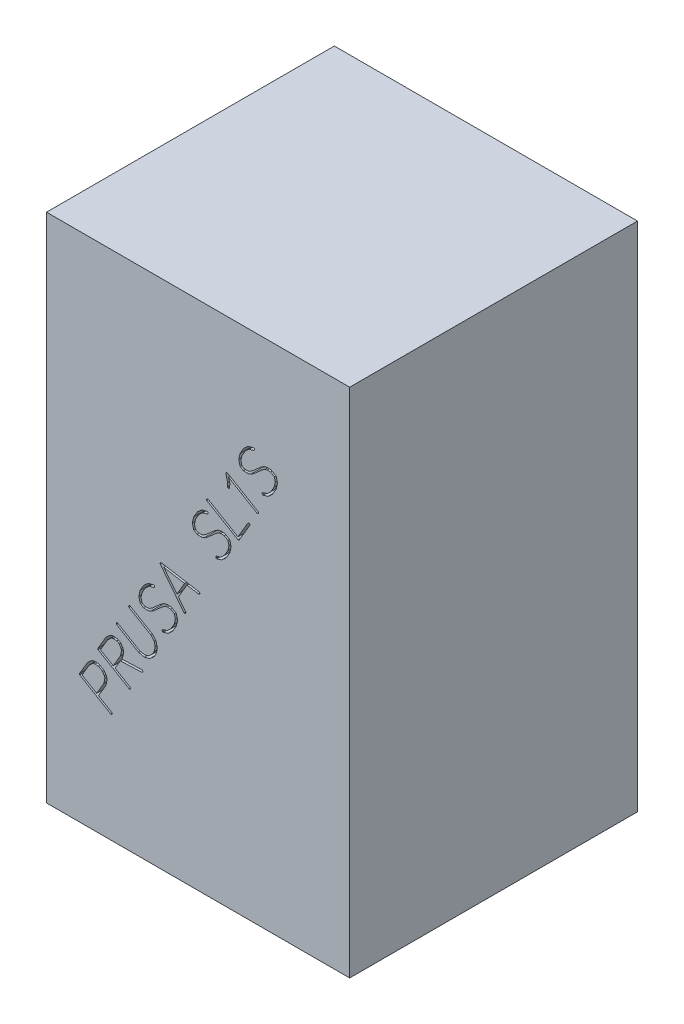
from build123d import *

# Parameters (mm, degrees)
SKETCH1_W           = 237
SKETCH1_H           = 225
BOSS_EXTRUDE1_DEPTH = 400
CUT_EXTRUDE1_DEPTH  = 10


with BuildPart() as part:
    # Sketch1 → Boss-Extrude1 (new body)
    with BuildSketch(Plane(origin=(0, 0, 0), x_dir=(1, 0, 0), z_dir=(0, 1, 0))):
        Rectangle(SKETCH1_W, SKETCH1_H)
    extrude(amount=BOSS_EXTRUDE1_DEPTH)

    # Sketch2 → Cut-Extrude1 (cut)
    # profile 1 of 9: a face of its own
    with BuildSketch(Plane.XY.offset(112.5)):
        with BuildLine():
            add(Edge.make_bspline(
                [(35.778543298, 317.308124803), (35.877040943, 317.393792287), (36.084996192, 317.574659586), (36.416167595, 317.858900146), (36.778572841, 318.17947466), (37.178133588, 318.525376974), (37.604437568, 318.910523101), (38.065976907, 319.321349269), (38.564258813, 319.762228323), (38.905585722, 320.06833694), (39.082114727, 320.226651588)],
                knots=[0, 0, 0, 0, 0.710714246, 1.500510576, 2.376035372, 3.344923501, 4.377705294, 5.503836424, 6.709022758, 8, 8, 8, 8], degree=3))
            add(Edge.make_bspline(
                [(39.082114727, 320.226651588), (39.176795353, 320.258851624), (39.387368698, 320.330465738), (39.737940496, 320.4340587), (40.15495934, 320.551885846), (40.634846682, 320.684097052), (41.181144498, 320.831467169), (41.791839244, 320.985608201), (42.469452768, 321.152739849), (42.941879433, 321.270105687), (43.189257584, 321.331562303)],
                knots=[0, 0, 0, 0, 0.564128498, 1.254643417, 2.061841092, 3.008894917, 4.062716452, 5.253833597, 6.562016889, 8, 8, 8, 8], degree=3))
            add(Edge.make_bspline(
                [(43.189257584, 321.331562303), (43.280184906, 321.333272937), (43.452563069, 321.336515923), (43.607241511, 321.261147867), (43.680329012, 321.225535517)],
                knots=[0, 0, 0, 0, 1.054974954, 2, 2, 2, 2], degree=3))
            add(Edge.make_bspline(
                [(43.680329012, 321.225535517), (43.721416927, 321.201873234), (43.793607019, 321.160299394), (43.847040167, 321.096690567), (43.870061155, 321.069285517)],
                knots=[0, 0, 0, 0, 1.138325568, 2, 2, 2, 2], degree=3))
            add(Edge.make_bspline(
                [(43.870061155, 321.069285517), (43.916454168, 321.013910097), (44.007720772, 320.904972861), (44.082450358, 320.699783826), (44.092100083, 320.475024182), (44.056222736, 320.326563969), (44.03747187, 320.248973017)],
                knots=[0, 0, 0, 0, 0.978819244, 1.925581099, 2.915829813, 4, 4, 4, 4], degree=3))
            add(Edge.make_bspline(
                [(44.03747187, 320.248973017), (43.993205306, 320.172883413), (43.911565362, 320.032552867), (43.768047428, 319.863373719), (43.645703485, 319.722320629), (43.546306855, 319.673676814), (43.501757584, 319.651874803)],
                knots=[0, 0, 0, 0, 1.292847548, 2.384373082, 3.275880872, 4, 4, 4, 4], degree=3))
            Line((43.501757584, 319.651874803), (39.908007584, 318.71995516))
            Line((39.908007584, 318.71995516), (36.972739727, 316.14183016))
            Line((36.972739727, 316.14183016), (34.266266512, 311.565937303))
            Line((34.266266512, 311.565937303), (33.418052227, 307.849419445))
            Line((33.418052227, 307.849419445), (34.227204012, 304.646294445))
            Line((34.227204012, 304.646294445), (36.051980798, 303.56370516))
            Line((36.051980798, 303.56370516), (38.713811155, 303.429776588))
            Line((38.713811155, 303.429776588), (40.231668298, 303.870624803))
            Line((40.231668298, 303.870624803), (42.720507584, 305.55589266))
            Line((42.720507584, 305.55589266), (49.126757584, 311.203214088))
            Line((49.126757584, 311.203214088), (51.688141512, 312.854999803))
            add(Edge.make_bspline(
                [(51.688141512, 312.854999803), (51.860698851, 312.906796304), (52.238543859, 313.020213964), (52.866313376, 313.168602277), (53.602346972, 313.310891328), (54.130259381, 313.399393235), (54.411355798, 313.44651766)],
                knots=[0, 0, 0, 0, 0.775019935, 1.697044106, 2.773749891, 4, 4, 4, 4], degree=3))
            Line((54.411355798, 313.44651766), (57.089927227, 313.25120516))
            add(Edge.make_bspline(
                [(57.089927227, 313.25120516), (57.201541122, 313.18797307), (57.43781714, 313.054116741), (57.81165983, 312.841989554), (58.226951191, 312.606609336), (58.683574095, 312.345856533), (59.178361854, 312.054328061), (59.716074827, 311.743374963), (60.289945271, 311.400128553), (60.689022434, 311.167472165), (60.895730798, 311.046964088)],
                knots=[0, 0, 0, 0, 0.700007414, 1.481849224, 2.345525519, 3.304882817, 4.351158632, 5.479265799, 6.694345629, 8, 8, 8, 8], degree=3))
            Line((60.895730798, 311.046964088), (61.096623655, 310.740044445))
            Line((61.096623655, 310.740044445), (62.022962941, 306.80589266))
            add(Edge.make_bspline(
                [(62.022962941, 306.80589266), (62.003773491, 306.655032006), (61.959534782, 306.307242959), (61.849824468, 305.721014843), (61.690032164, 305.002599804), (61.569473546, 304.478798595), (61.503989727, 304.194285517)],
                knots=[0, 0, 0, 0, 0.684898989, 1.578942961, 2.684954564, 4, 4, 4, 4], degree=3))
            Line((61.503989727, 304.194285517), (61.063141512, 302.263481945))
            Line((61.063141512, 302.263481945), (58.072070084, 297.207678374))
            add(Edge.make_bspline(
                [(58.072070084, 297.207678374), (57.977329722, 297.120115765), (57.775261952, 296.933357125), (57.453507664, 296.641435557), (57.101484524, 296.314209352), (56.710487725, 295.962994373), (56.279326246, 295.585429192), (55.81852486, 295.171674046), (55.319723605, 294.731381062), (54.978471246, 294.425188317), (54.801980798, 294.26683016)],
                knots=[0, 0, 0, 0, 0.703981311, 1.501492399, 2.370711845, 3.326641466, 4.369382731, 5.498101253, 6.706056617, 8, 8, 8, 8], degree=3))
            Line((54.801980798, 294.26683016), (54.550864727, 294.132901588))
            Line((54.550864727, 294.132901588), (50.823186155, 293.000089088))
            add(Edge.make_bspline(
                [(50.823186155, 293.000089088), (50.747593504, 293.015543311), (50.548182464, 293.056311067), (50.373570548, 293.162776912), (50.265150441, 293.228883731)],
                knots=[0, 0, 0, 0, 0.758159134, 2, 2, 2, 2], degree=3))
            add(Edge.make_bspline(
                [(50.265150441, 293.228883731), (50.218697931, 293.291935843), (50.127699127, 293.415452671), (50.055114181, 293.634534212), (50.037947131, 293.86823763), (50.066170097, 294.023450037), (50.080998655, 294.104999803)],
                knots=[0, 0, 0, 0, 1.005767381, 1.970262281, 2.933560538, 4, 4, 4, 4], degree=3))
            add(Edge.make_bspline(
                [(50.080998655, 294.104999803), (50.127422411, 294.180845954), (50.211846645, 294.318776484), (50.35530305, 294.489860713), (50.488720024, 294.618602043), (50.589377307, 294.665027676), (50.633454012, 294.685356945)],
                knots=[0, 0, 0, 0, 1.307030055, 2.376908326, 3.289266187, 4, 4, 4, 4], degree=3))
            Line((50.633454012, 294.685356945), (54.003989727, 295.75120516))
            Line((54.003989727, 295.75120516), (56.816489727, 298.346071231))
            Line((56.816489727, 298.346071231), (59.539704012, 302.949865874))
            Line((59.539704012, 302.949865874), (60.343275441, 306.671964088))
            Line((60.343275441, 306.671964088), (59.595507584, 309.886249803))
            Line((59.595507584, 309.886249803), (56.671400441, 311.616160517))
            Line((56.671400441, 311.616160517), (54.015150441, 311.755669445))
            Line((54.015150441, 311.755669445), (52.408007584, 311.320401588))
            Line((52.408007584, 311.320401588), (49.919168298, 309.635133731))
            Line((49.919168298, 309.635133731), (43.579882584, 304.015714088))
            Line((43.579882584, 304.015714088), (41.007337941, 302.336026588))
            add(Edge.make_bspline(
                [(41.007337941, 302.336026588), (40.761982101, 302.262861747), (40.275687606, 302.117849263), (39.787273302, 301.980145781), (39.54528437, 301.911919445)],
                knots=[0, 0, 0, 0, 1.009083353, 2, 2, 2, 2], degree=3))
            add(Edge.make_bspline(
                [(39.54528437, 301.911919445), (39.402724088, 301.87145811), (39.13495644, 301.795460528), (38.74961073, 301.737268188), (38.409037868, 301.707872397), (38.202051272, 301.744277439), (38.105552227, 301.761249803)],
                knots=[0, 0, 0, 0, 1.214717975, 2.281576415, 3.198855204, 4, 4, 4, 4], degree=3))
            add(Edge.make_bspline(
                [(38.105552227, 301.761249803), (38.031139774, 301.766729245), (37.861826612, 301.779196807), (37.579308704, 301.802632143), (37.238855229, 301.824649176), (36.859050971, 301.843278016), (36.476185477, 301.872462983), (36.126472097, 301.89476784), (35.826801032, 301.910205216), (35.64460073, 301.922851575), (35.56090937, 301.928660517)],
                knots=[0, 0, 0, 0, 0.702189196, 1.597714749, 2.667847535, 3.912713514, 5.176149666, 6.281220926, 7.21050098, 8, 8, 8, 8], degree=3))
            Line((35.56090937, 301.928660517), (32.977204012, 303.452098017))
            add(Edge.make_bspline(
                [(32.977204012, 303.452098017), (32.937655505, 303.479591537), (32.853568061, 303.538047847), (32.769916615, 303.680835128), (32.69418031, 303.849844024), (32.651641163, 304.046124907), (32.62419122, 304.235557507), (32.593978321, 304.387399072), (32.579750379, 304.490523168), (32.568150926, 304.540300897), (32.564257584, 304.557008731)],
                knots=[0, 0, 0, 0, 0.941468605, 2.001736437, 3.203565702, 4.603275245, 5.944822685, 6.990332666, 7.661106386, 8, 8, 8, 8], degree=3))
            Line((32.564257584, 304.557008731), (31.783007584, 307.648526588))
            Line((31.783007584, 307.648526588), (31.794168298, 307.972187303))
            add(Edge.make_bspline(
                [(31.794168298, 307.972187303), (31.819577303, 308.100670287), (31.873091955, 308.371272079), (31.970996174, 308.796201832), (32.076158197, 309.265137764), (32.19402983, 309.778376589), (32.320772755, 310.337228572), (32.467063041, 310.937333915), (32.623611766, 311.580858609), (32.731639683, 312.023533227), (32.78747187, 312.252321231)],
                knots=[0, 0, 0, 0, 0.715295004, 1.506503851, 2.381467221, 3.340189223, 4.382672976, 5.511255477, 6.713739459, 8, 8, 8, 8], degree=3))
            Line((32.78747187, 312.252321231), (32.837695084, 312.414151588))
            Line((32.837695084, 312.414151588), (35.778543298, 317.308124803))
        make_face()
    # profile 2 of 9: a face of its own
    with BuildSketch(Plane.XY.offset(112.5)):
        with BuildLine():
            Line((22.494978668, 294.263182615), (22.835380454, 294.19621833))
            Line((22.835380454, 294.19621833), (47.093192954, 279.854700473))
            add(Edge.make_bspline(
                [(47.093192954, 279.854700473), (47.151828053, 279.796829986), (47.263750385, 279.686367141), (47.355485879, 279.461164994), (47.351098366, 279.207014978), (47.288674171, 279.044090355), (47.255023311, 278.956262973)],
                knots=[0, 0, 0, 0, 0.991990795, 1.893506187, 2.864457477, 4, 4, 4, 4], degree=3))
            add(Edge.make_bspline(
                [(47.255023311, 278.956262973), (47.19549637, 278.862222588), (47.08795704, 278.692332456), (46.890839338, 278.498479914), (46.675736879, 278.38605218), (46.528827242, 278.390482027), (46.45703224, 278.392646901)],
                knots=[0, 0, 0, 0, 1.28529316, 2.321966526, 3.179942047, 4, 4, 4, 4], degree=3))
            Line((46.45703224, 278.392646901), (46.244978668, 278.426129044))
            Line((46.244978668, 278.426129044), (23.856585811, 291.668316544))
            Line((23.856585811, 291.668316544), (24.827567954, 287.957379044))
            Line((24.827567954, 287.957379044), (24.576451883, 284.737512973))
            add(Edge.make_bspline(
                [(24.576451883, 284.737512973), (24.572651633, 284.70715226), (24.564153344, 284.639258266), (24.52894921, 284.580347813), (24.509487597, 284.54778083)],
                knots=[0, 0, 0, 0, 0.894356357, 2, 2, 2, 2], degree=3))
            add(Edge.make_bspline(
                [(24.509487597, 284.54778083), (24.445695072, 284.465734679), (24.313195896, 284.295322119), (24.010127756, 284.14872792), (23.651052184, 284.108724378), (23.433733052, 284.214058981), (23.320871526, 284.268762973)],
                knots=[0, 0, 0, 0, 0.912684627, 1.895676054, 2.907150005, 4, 4, 4, 4], degree=3))
            add(Edge.make_bspline(
                [(23.320871526, 284.268762973), (23.27912592, 284.297502402), (23.200422278, 284.351685299), (23.130494339, 284.416771097), (23.09765724, 284.447334401)],
                knots=[0, 0, 0, 0, 1.060830323, 2, 2, 2, 2], degree=3))
            add(Edge.make_bspline(
                [(23.09765724, 284.447334401), (23.042727912, 284.543394025), (22.941401876, 284.720591553), (22.926094833, 284.923582323), (22.919085811, 285.01653083)],
                knots=[0, 0, 0, 0, 1.084209533, 2, 2, 2, 2], degree=3))
            Line((22.919085811, 285.01653083), (23.125559026, 287.812289758))
            Line((23.125559026, 287.812289758), (21.696987597, 293.292200473))
            add(Edge.make_bspline(
                [(21.696987597, 293.292200473), (21.69035415, 293.371615562), (21.675713948, 293.546886872), (21.758007745, 293.703306215), (21.803014383, 293.788852258)],
                knots=[0, 0, 0, 0, 0.906196109, 2, 2, 2, 2], degree=3))
            add(Edge.make_bspline(
                [(21.803014383, 293.788852258), (21.839796332, 293.842923869), (21.915334031, 293.953968692), (22.076293878, 294.086396858), (22.270370378, 294.196273226), (22.41750087, 294.240102469), (22.494978668, 294.263182615)],
                knots=[0, 0, 0, 0, 0.908199104, 1.865134192, 2.875795909, 4, 4, 4, 4], degree=3))
        make_face()
    # profile 3 of 9: a face of its own
    with BuildSketch(Plane.XY.offset(112.5)):
        with BuildLine():
            Line((7.61267342, 268.889872259), (7.841468063, 268.800586544))
            Line((7.841468063, 268.800586544), (31.150619849, 255.017104402))
            Line((31.150619849, 255.017104402), (39.041244849, 268.365318687))
            add(Edge.make_bspline(
                [(39.041244849, 268.365318687), (39.100516626, 268.431503787), (39.212387818, 268.556423376), (39.437652166, 268.663869317), (39.683990886, 268.680771561), (39.84018556, 268.631421108), (39.922941278, 268.605274044)],
                knots=[0, 0, 0, 0, 1.071592764, 2.022553815, 2.952301171, 4, 4, 4, 4], degree=3))
            add(Edge.make_bspline(
                [(39.922941278, 268.605274044), (40.018789306, 268.545579485), (40.195341803, 268.435621838), (40.39820587, 268.234867858), (40.535327461, 268.026592227), (40.547674971, 267.877757594), (40.553521635, 267.807282973)],
                knots=[0, 0, 0, 0, 1.269355503, 2.338158531, 3.213102186, 4, 4, 4, 4], degree=3))
            Line((40.553521635, 267.807282973), (40.475396635, 267.522684759))
            Line((40.475396635, 267.522684759), (32.021155563, 253.231390116))
            add(Edge.make_bspline(
                [(32.021155563, 253.231390116), (31.962772185, 253.178347372), (31.85119811, 253.076979563), (31.634759872, 253.001918087), (31.404254075, 252.995922494), (31.255785068, 253.044355283), (31.178521635, 253.069559759)],
                knots=[0, 0, 0, 0, 1.026456168, 1.9616182, 2.939223888, 4, 4, 4, 4], degree=3))
            Line((31.178521635, 253.069559759), (6.853744849, 267.450140116))
            add(Edge.make_bspline(
                [(6.853744849, 267.450140116), (6.804709919, 267.512762317), (6.709630893, 267.634187144), (6.641954264, 267.856239182), (6.640764683, 268.090112342), (6.692704233, 268.237933807), (6.719816278, 268.315095473)],
                knots=[0, 0, 0, 0, 1.022800667, 1.983216686, 2.947254651, 4, 4, 4, 4], degree=3))
            add(Edge.make_bspline(
                [(6.719816278, 268.315095473), (6.773082048, 268.398926454), (6.875625765, 268.56031228), (7.09610088, 268.733012924), (7.340825446, 268.856356379), (7.520010942, 268.878447989), (7.61267342, 268.889872259)],
                knots=[0, 0, 0, 0, 1.068799334, 2.05758134, 2.995513966, 4, 4, 4, 4], degree=3))
        make_face()
    # profile 4 of 9: a face of its own
    with BuildSketch(Plane.XY.offset(112.5)):
        with BuildLine():
            add(Edge.make_bspline(
                [(-0.44965067, 256.163493632), (-0.351153025, 256.249161116), (-0.143197776, 256.430028416), (0.187973626, 256.714268975), (0.550378872, 257.03484349), (0.949939619, 257.380745804), (1.3762436, 257.76589193), (1.837782939, 258.176718098), (2.336064845, 258.617597153), (2.677391754, 258.92370577), (2.853920758, 259.082020418)],
                knots=[0, 0, 0, 0, 0.710714246, 1.500510576, 2.376035372, 3.344923501, 4.377705294, 5.503836424, 6.709022758, 8, 8, 8, 8], degree=3))
            add(Edge.make_bspline(
                [(2.853920758, 259.082020418), (2.948601385, 259.114220453), (3.15917473, 259.185834567), (3.509746527, 259.289427529), (3.926765372, 259.407254676), (4.406652714, 259.539465881), (4.952950529, 259.686835998), (5.563645276, 259.840977031), (6.2412588, 260.008108679), (6.713685465, 260.125474517), (6.961063615, 260.186931132)],
                knots=[0, 0, 0, 0, 0.564128498, 1.254643417, 2.061841092, 3.008894917, 4.062716452, 5.253833597, 6.562016889, 8, 8, 8, 8], degree=3))
            add(Edge.make_bspline(
                [(6.961063615, 260.186931132), (7.051990938, 260.188641767), (7.224369101, 260.191884753), (7.379047543, 260.116516697), (7.452135044, 260.080904346)],
                knots=[0, 0, 0, 0, 1.054974954, 2, 2, 2, 2], degree=3))
            add(Edge.make_bspline(
                [(7.452135044, 260.080904346), (7.493222958, 260.057242064), (7.565413051, 260.015668223), (7.618846198, 259.952059396), (7.641867187, 259.924654346)],
                knots=[0, 0, 0, 0, 1.138325568, 2, 2, 2, 2], degree=3))
            add(Edge.make_bspline(
                [(7.641867187, 259.924654346), (7.6882602, 259.869278926), (7.779526804, 259.760341691), (7.85425639, 259.555152655), (7.863906115, 259.330393012), (7.828028767, 259.181932798), (7.809277901, 259.104341846)],
                knots=[0, 0, 0, 0, 0.978819244, 1.925581099, 2.915829813, 4, 4, 4, 4], degree=3))
            add(Edge.make_bspline(
                [(7.809277901, 259.104341846), (7.765011338, 259.028252243), (7.683371394, 258.887921697), (7.53985346, 258.718742548), (7.417509517, 258.577689459), (7.318112886, 258.529045644), (7.273563615, 258.507243632)],
                knots=[0, 0, 0, 0, 1.292847548, 2.384373082, 3.275880872, 4, 4, 4, 4], degree=3))
            Line((7.273563615, 258.507243632), (3.679813615, 257.575323989))
            Line((3.679813615, 257.575323989), (0.744545758, 254.997198989))
            Line((0.744545758, 254.997198989), (-1.961927456, 250.421306132))
            Line((-1.961927456, 250.421306132), (-2.810141742, 246.704788275))
            Line((-2.810141742, 246.704788275), (-2.000989956, 243.501663275))
            Line((-2.000989956, 243.501663275), (-0.17621317, 242.419073989))
            Line((-0.17621317, 242.419073989), (2.485617187, 242.285145418))
            Line((2.485617187, 242.285145418), (4.00347433, 242.725993632))
            Line((4.00347433, 242.725993632), (6.492313615, 244.411261489))
            Line((6.492313615, 244.411261489), (12.898563615, 250.058582918))
            Line((12.898563615, 250.058582918), (15.459947544, 251.710368632))
            add(Edge.make_bspline(
                [(15.459947544, 251.710368632), (15.632504882, 251.762165133), (16.01034989, 251.875582793), (16.638119408, 252.023971106), (17.374153004, 252.166260158), (17.902065413, 252.254762064), (18.18316183, 252.301886489)],
                knots=[0, 0, 0, 0, 0.775019935, 1.697044106, 2.773749891, 4, 4, 4, 4], degree=3))
            Line((18.18316183, 252.301886489), (20.861733258, 252.106573989))
            add(Edge.make_bspline(
                [(20.861733258, 252.106573989), (20.973347154, 252.0433419), (21.209623172, 251.90948557), (21.583465861, 251.697358384), (21.998757223, 251.461978166), (22.455380126, 251.201225363), (22.950167885, 250.90969689), (23.487880858, 250.598743792), (24.061751302, 250.255497382), (24.460828466, 250.022840994), (24.66753683, 249.902332918)],
                knots=[0, 0, 0, 0, 0.700007414, 1.481849224, 2.345525519, 3.304882817, 4.351158632, 5.479265799, 6.694345629, 8, 8, 8, 8], degree=3))
            Line((24.66753683, 249.902332918), (24.868429687, 249.595413275))
            Line((24.868429687, 249.595413275), (25.794768973, 245.661261489))
            add(Edge.make_bspline(
                [(25.794768973, 245.661261489), (25.775579523, 245.510400836), (25.731340814, 245.162611788), (25.621630499, 244.576383672), (25.461838195, 243.857968634), (25.341279577, 243.334167424), (25.275795758, 243.049654346)],
                knots=[0, 0, 0, 0, 0.684898989, 1.578942961, 2.684954564, 4, 4, 4, 4], degree=3))
            Line((25.275795758, 243.049654346), (24.834947544, 241.118850775))
            Line((24.834947544, 241.118850775), (21.843876115, 236.063047204))
            add(Edge.make_bspline(
                [(21.843876115, 236.063047204), (21.749135753, 235.975484595), (21.547067983, 235.788725955), (21.225313695, 235.496804386), (20.873290555, 235.169578182), (20.482293757, 234.818363203), (20.051132278, 234.440798022), (19.590330892, 234.027042876), (19.091529636, 233.586749892), (18.750277278, 233.280557147), (18.57378683, 233.122198989)],
                knots=[0, 0, 0, 0, 0.703981311, 1.501492399, 2.370711845, 3.326641466, 4.369382731, 5.498101253, 6.706056617, 8, 8, 8, 8], degree=3))
            Line((18.57378683, 233.122198989), (18.322670758, 232.988270418))
            Line((18.322670758, 232.988270418), (14.594992187, 231.855457918))
            add(Edge.make_bspline(
                [(14.594992187, 231.855457918), (14.519399536, 231.870912141), (14.319988496, 231.911679896), (14.145376579, 232.018145742), (14.036956473, 232.084252561)],
                knots=[0, 0, 0, 0, 0.758159134, 2, 2, 2, 2], degree=3))
            add(Edge.make_bspline(
                [(14.036956473, 232.084252561), (13.990503962, 232.147304672), (13.899505158, 232.270821501), (13.826920212, 232.489903042), (13.809753163, 232.723606459), (13.837976128, 232.878818866), (13.852804687, 232.960368632)],
                knots=[0, 0, 0, 0, 1.005767381, 1.970262281, 2.933560538, 4, 4, 4, 4], degree=3))
            add(Edge.make_bspline(
                [(13.852804687, 232.960368632), (13.899228442, 233.036214783), (13.983652677, 233.174145314), (14.127109082, 233.345229542), (14.260526056, 233.473970873), (14.361183338, 233.520396506), (14.405260044, 233.540725775)],
                knots=[0, 0, 0, 0, 1.307030055, 2.376908326, 3.289266187, 4, 4, 4, 4], degree=3))
            Line((14.405260044, 233.540725775), (17.775795758, 234.606573989))
            Line((17.775795758, 234.606573989), (20.588295758, 237.201440061))
            Line((20.588295758, 237.201440061), (23.311510044, 241.805234704))
            Line((23.311510044, 241.805234704), (24.115081473, 245.527332918))
            Line((24.115081473, 245.527332918), (23.367313615, 248.741618632))
            Line((23.367313615, 248.741618632), (20.443206473, 250.471529346))
            Line((20.443206473, 250.471529346), (17.786956473, 250.611038275))
            Line((17.786956473, 250.611038275), (16.179813615, 250.175770418))
            Line((16.179813615, 250.175770418), (13.69097433, 248.490502561))
            Line((13.69097433, 248.490502561), (7.351688615, 242.871082918))
            Line((7.351688615, 242.871082918), (4.779143973, 241.191395418))
            add(Edge.make_bspline(
                [(4.779143973, 241.191395418), (4.533788133, 241.118230576), (4.047493638, 240.973218092), (3.559079333, 240.835514611), (3.317090401, 240.767288275)],
                knots=[0, 0, 0, 0, 1.009083353, 2, 2, 2, 2], degree=3))
            add(Edge.make_bspline(
                [(3.317090401, 240.767288275), (3.17453012, 240.726826939), (2.906762471, 240.650829358), (2.521416762, 240.592637017), (2.1808439, 240.563241226), (1.973857303, 240.599646268), (1.877358258, 240.616618632)],
                knots=[0, 0, 0, 0, 1.214717975, 2.281576415, 3.198855204, 4, 4, 4, 4], degree=3))
            add(Edge.make_bspline(
                [(1.877358258, 240.616618632), (1.802945806, 240.622098075), (1.633632643, 240.634565636), (1.351114735, 240.658000973), (1.010661261, 240.680018006), (0.630857003, 240.698646846), (0.247991508, 240.727831812), (-0.101721871, 240.75013667), (-0.401392937, 240.765574045), (-0.583593238, 240.778220404), (-0.667284599, 240.784029346)],
                knots=[0, 0, 0, 0, 0.702189196, 1.597714749, 2.667847535, 3.912713514, 5.176149666, 6.281220926, 7.21050098, 8, 8, 8, 8], degree=3))
            Line((-0.667284599, 240.784029346), (-3.250989956, 242.307466846))
            add(Edge.make_bspline(
                [(-3.250989956, 242.307466846), (-3.290538464, 242.334960367), (-3.374625907, 242.393416677), (-3.458277354, 242.536203958), (-3.534013658, 242.705212854), (-3.576552805, 242.901493737), (-3.604002748, 243.090926336), (-3.634215647, 243.242767901), (-3.64844359, 243.345891998), (-3.660043042, 243.395669727), (-3.663936385, 243.412377561)],
                knots=[0, 0, 0, 0, 0.941468605, 2.001736437, 3.203565702, 4.603275245, 5.944822685, 6.990332666, 7.661106386, 8, 8, 8, 8], degree=3))
            Line((-3.663936385, 243.412377561), (-4.445186385, 246.503895418))
            Line((-4.445186385, 246.503895418), (-4.43402567, 246.827556132))
            add(Edge.make_bspline(
                [(-4.43402567, 246.827556132), (-4.408616666, 246.956039116), (-4.355102013, 247.226640909), (-4.257197795, 247.651570662), (-4.152035771, 248.120506593), (-4.034164138, 248.633745419), (-3.907421213, 249.192597401), (-3.761130927, 249.792702745), (-3.604582203, 250.436227439), (-3.496554285, 250.878902056), (-3.440722099, 251.107690061)],
                knots=[0, 0, 0, 0, 0.715295004, 1.506503851, 2.381467221, 3.340189223, 4.382672976, 5.511255477, 6.713739459, 8, 8, 8, 8], degree=3))
            Line((-3.440722099, 251.107690061), (-3.390498885, 251.269520418))
            Line((-3.390498885, 251.269520418), (-0.44965067, 256.163493632))
        make_face()
    # profile 5 of 9: a face of its own
    with BuildSketch(Plane.XY.offset(112.5)):
        with BuildLine():
            Line((-28.823840696, 207.489171256), (0.830177161, 202.57845697))
            add(Edge.make_bspline(
                [(0.830177161, 202.57845697), (0.897319236, 202.536430088), (1.022634953, 202.457990022), (1.171090224, 202.307022294), (1.283437415, 202.148974095), (1.346113072, 201.971194309), (1.360403578, 201.782118388), (1.339565789, 201.581381989), (1.259801382, 201.372665994), (1.187029404, 201.234603833), (1.148257518, 201.161046256)],
                knots=[0, 0, 0, 0, 1.138355934, 2.124657143, 3.032318744, 3.914656472, 4.803494014, 5.748440273, 6.800400662, 8, 8, 8, 8], degree=3))
            add(Edge.make_bspline(
                [(1.148257518, 201.161046256), (1.073957054, 201.11226635), (0.924456273, 201.014115765), (0.65635616, 200.940034249), (0.362755308, 200.908068447), (0.160381744, 200.938600055), (0.054507518, 200.954573042)],
                knots=[0, 0, 0, 0, 0.926323999, 1.863866688, 2.882455506, 4, 4, 4, 4], degree=3))
            add(Edge.make_bspline(
                [(0.054507518, 200.954573042), (-0.128194673, 200.986069389), (-0.499047821, 201.050001407), (-0.864826667, 201.138478939), (-1.050403196, 201.183367685)],
                knots=[0, 0, 0, 0, 0.985307481, 2, 2, 2, 2], degree=3))
            Line((-1.050403196, 201.183367685), (-8.71781391, 202.411046256))
            Line((-8.71781391, 202.411046256), (-15.430983553, 191.060599827))
            Line((-15.430983553, 191.060599827), (-9.705537125, 183.661046256))
            add(Edge.make_bspline(
                [(-9.705537125, 183.661046256), (-9.663333325, 183.60008081), (-9.582941124, 183.483950358), (-9.543755052, 183.271127789), (-9.572923178, 183.049558743), (-9.644836963, 182.913399051), (-9.683215696, 182.840733756)],
                knots=[0, 0, 0, 0, 1.002888197, 1.910358533, 2.884806428, 4, 4, 4, 4], degree=3))
            add(Edge.make_bspline(
                [(-9.683215696, 182.840733756), (-9.736085225, 182.756628363), (-9.833042162, 182.602388267), (-10.039825641, 182.442074219), (-10.271324536, 182.358434878), (-10.428640325, 182.378474439), (-10.509108553, 182.388724827)],
                knots=[0, 0, 0, 0, 1.169091903, 2.143986745, 3.050635031, 4, 4, 4, 4], degree=3))
            add(Edge.make_bspline(
                [(-10.509108553, 182.388724827), (-10.527614954, 182.394682091), (-10.580538859, 182.41171845), (-10.672659065, 182.42470551), (-10.770841274, 182.457799349), (-10.832888514, 182.483323023), (-10.860671053, 182.494751613)],
                knots=[0, 0, 0, 0, 0.633348993, 1.811227536, 3.019945812, 4, 4, 4, 4], degree=3))
            add(Edge.make_bspline(
                [(-10.860671053, 182.494751613), (-10.899033432, 182.517791921), (-10.95950454, 182.554110654), (-10.997462834, 182.612802372), (-11.011340696, 182.634260542)],
                knots=[0, 0, 0, 0, 1.268783707, 2, 2, 2, 2], degree=3))
            Line((-11.011340696, 182.634260542), (-29.588349625, 206.194528399))
            add(Edge.make_bspline(
                [(-29.588349625, 206.194528399), (-29.616443115, 206.260521804), (-29.671122655, 206.388967538), (-29.686427964, 206.597822854), (-29.682385956, 206.809398017), (-29.63509169, 206.944882692), (-29.610671053, 207.014840899)],
                knots=[0, 0, 0, 0, 1.013171244, 1.971977723, 2.952820303, 4, 4, 4, 4], degree=3))
            add(Edge.make_bspline(
                [(-29.610671053, 207.014840899), (-29.562121834, 207.088444741), (-29.469717363, 207.228536057), (-29.280771394, 207.385058184), (-29.060075331, 207.475325319), (-28.904680049, 207.484433185), (-28.823840696, 207.489171256)],
                knots=[0, 0, 0, 0, 1.091025863, 2.076566173, 2.999395974, 4, 4, 4, 4], degree=3))
        make_face()
        Polygon((-16.502412125, 192.50033197), (-10.497947839, 202.65658197), (-26.798171053, 205.396537327), align=None, mode=Mode.SUBTRACT)
    # profile 6 of 9: a face of its own
    with BuildSketch(Plane.XY.offset(112.5)):
        with BuildLine():
            add(Edge.make_bspline(
                [(-42.321432644, 185.493819415), (-42.222934999, 185.579486899), (-42.01497975, 185.760354199), (-41.683808347, 186.044594758), (-41.321403101, 186.365169272), (-40.921842354, 186.711071587), (-40.495538374, 187.096217713), (-40.033999035, 187.507043881), (-39.535717129, 187.947922936), (-39.19439022, 188.254031553), (-39.017861215, 188.412346201)],
                knots=[0, 0, 0, 0, 0.710714246, 1.500510576, 2.376035372, 3.344923501, 4.377705294, 5.503836424, 6.709022758, 8, 8, 8, 8], degree=3))
            add(Edge.make_bspline(
                [(-39.017861215, 188.412346201), (-38.923180589, 188.444546236), (-38.712607244, 188.51616035), (-38.362035446, 188.619753312), (-37.945016602, 188.737580459), (-37.46512926, 188.869791664), (-36.918831444, 189.017161781), (-36.308136698, 189.171302814), (-35.630523174, 189.338434462), (-35.158096509, 189.4558003), (-34.910718358, 189.517256915)],
                knots=[0, 0, 0, 0, 0.564128498, 1.254643417, 2.061841092, 3.008894917, 4.062716452, 5.253833597, 6.562016889, 8, 8, 8, 8], degree=3))
            add(Edge.make_bspline(
                [(-34.910718358, 189.517256915), (-34.819791036, 189.51896755), (-34.647412873, 189.522210536), (-34.492734431, 189.44684248), (-34.41964693, 189.411230129)],
                knots=[0, 0, 0, 0, 1.054974954, 2, 2, 2, 2], degree=3))
            add(Edge.make_bspline(
                [(-34.41964693, 189.411230129), (-34.378559015, 189.387567847), (-34.306368923, 189.345994006), (-34.252935775, 189.282385179), (-34.229914787, 189.254980129)],
                knots=[0, 0, 0, 0, 1.138325568, 2, 2, 2, 2], degree=3))
            add(Edge.make_bspline(
                [(-34.229914787, 189.254980129), (-34.183521774, 189.199604709), (-34.09225517, 189.090667474), (-34.017525584, 188.885478438), (-34.007875859, 188.660718795), (-34.043753206, 188.512258581), (-34.062504072, 188.434667629)],
                knots=[0, 0, 0, 0, 0.978819244, 1.925581099, 2.915829813, 4, 4, 4, 4], degree=3))
            add(Edge.make_bspline(
                [(-34.062504072, 188.434667629), (-34.106770636, 188.358578026), (-34.18841058, 188.21824748), (-34.331928514, 188.049068331), (-34.454272457, 187.908015242), (-34.553669087, 187.859371427), (-34.598218358, 187.837569415)],
                knots=[0, 0, 0, 0, 1.292847548, 2.384373082, 3.275880872, 4, 4, 4, 4], degree=3))
            Line((-34.598218358, 187.837569415), (-38.191968358, 186.905649772))
            Line((-38.191968358, 186.905649772), (-41.127236215, 184.327524772))
            Line((-41.127236215, 184.327524772), (-43.83370943, 179.751631915))
            Line((-43.83370943, 179.751631915), (-44.681923715, 176.035114058))
            Line((-44.681923715, 176.035114058), (-43.87277193, 172.831989058))
            Line((-43.87277193, 172.831989058), (-42.047995144, 171.749399772))
            Line((-42.047995144, 171.749399772), (-39.386164787, 171.615471201))
            Line((-39.386164787, 171.615471201), (-37.868307644, 172.056319415))
            Line((-37.868307644, 172.056319415), (-35.379468358, 173.741587272))
            Line((-35.379468358, 173.741587272), (-28.973218358, 179.388908701))
            Line((-28.973218358, 179.388908701), (-26.41183443, 181.040694415))
            add(Edge.make_bspline(
                [(-26.41183443, 181.040694415), (-26.239277092, 181.092490916), (-25.861432083, 181.205908576), (-25.233662566, 181.354296889), (-24.49762897, 181.496585941), (-23.969716561, 181.585087847), (-23.688620144, 181.632212272)],
                knots=[0, 0, 0, 0, 0.775019935, 1.697044106, 2.773749891, 4, 4, 4, 4], degree=3))
            Line((-23.688620144, 181.632212272), (-21.010048715, 181.436899772))
            add(Edge.make_bspline(
                [(-21.010048715, 181.436899772), (-20.89843482, 181.373667683), (-20.662158802, 181.239811353), (-20.288316112, 181.027684167), (-19.873024751, 180.792303949), (-19.416401848, 180.531551146), (-18.921614088, 180.240022673), (-18.383901115, 179.929069575), (-17.810030671, 179.585823165), (-17.410953508, 179.353166777), (-17.204245144, 179.232658701)],
                knots=[0, 0, 0, 0, 0.700007414, 1.481849224, 2.345525519, 3.304882817, 4.351158632, 5.479265799, 6.694345629, 8, 8, 8, 8], degree=3))
            Line((-17.204245144, 179.232658701), (-17.003352287, 178.925739058))
            Line((-17.003352287, 178.925739058), (-16.077013001, 174.991587272))
            add(Edge.make_bspline(
                [(-16.077013001, 174.991587272), (-16.096202451, 174.840726619), (-16.14044116, 174.492937571), (-16.250151475, 173.906709455), (-16.409943778, 173.188294417), (-16.530502397, 172.664493207), (-16.595986215, 172.379980129)],
                knots=[0, 0, 0, 0, 0.684898989, 1.578942961, 2.684954564, 4, 4, 4, 4], degree=3))
            Line((-16.595986215, 172.379980129), (-17.03683443, 170.449176558))
            Line((-17.03683443, 170.449176558), (-20.027905858, 165.393372986))
            add(Edge.make_bspline(
                [(-20.027905858, 165.393372986), (-20.12264622, 165.305810377), (-20.32471399, 165.119051738), (-20.646468278, 164.827130169), (-20.998491419, 164.499903965), (-21.389488217, 164.148688985), (-21.820649696, 163.771123804), (-22.281451082, 163.357368659), (-22.780252337, 162.917075675), (-23.121504696, 162.61088293), (-23.297995144, 162.452524772)],
                knots=[0, 0, 0, 0, 0.703981311, 1.501492399, 2.370711845, 3.326641466, 4.369382731, 5.498101253, 6.706056617, 8, 8, 8, 8], degree=3))
            Line((-23.297995144, 162.452524772), (-23.549111215, 162.318596201))
            Line((-23.549111215, 162.318596201), (-27.276789787, 161.185783701))
            add(Edge.make_bspline(
                [(-27.276789787, 161.185783701), (-27.352382438, 161.201237924), (-27.551793478, 161.242005679), (-27.726405394, 161.348471525), (-27.834825501, 161.414578344)],
                knots=[0, 0, 0, 0, 0.758159134, 2, 2, 2, 2], degree=3))
            add(Edge.make_bspline(
                [(-27.834825501, 161.414578344), (-27.881278011, 161.477630455), (-27.972276815, 161.601147284), (-28.044861761, 161.820228825), (-28.062028811, 162.053932242), (-28.033805845, 162.209144649), (-28.018977287, 162.290694415)],
                knots=[0, 0, 0, 0, 1.005767381, 1.970262281, 2.933560538, 4, 4, 4, 4], degree=3))
            add(Edge.make_bspline(
                [(-28.018977287, 162.290694415), (-27.972553531, 162.366540566), (-27.888129297, 162.504471097), (-27.744672892, 162.675555325), (-27.611255918, 162.804296656), (-27.510598635, 162.850722289), (-27.46652193, 162.871051558)],
                knots=[0, 0, 0, 0, 1.307030055, 2.376908326, 3.289266187, 4, 4, 4, 4], degree=3))
            Line((-27.46652193, 162.871051558), (-24.095986215, 163.936899772))
            Line((-24.095986215, 163.936899772), (-21.283486215, 166.531765844))
            Line((-21.283486215, 166.531765844), (-18.56027193, 171.135560486))
            Line((-18.56027193, 171.135560486), (-17.756700501, 174.857658701))
            Line((-17.756700501, 174.857658701), (-18.504468358, 178.071944415))
            Line((-18.504468358, 178.071944415), (-21.428575501, 179.801855129))
            Line((-21.428575501, 179.801855129), (-24.084825501, 179.941364058))
            Line((-24.084825501, 179.941364058), (-25.691968358, 179.506096201))
            Line((-25.691968358, 179.506096201), (-28.180807644, 177.820828344))
            Line((-28.180807644, 177.820828344), (-34.520093358, 172.201408701))
            Line((-34.520093358, 172.201408701), (-37.092638001, 170.521721201))
            add(Edge.make_bspline(
                [(-37.092638001, 170.521721201), (-37.337993841, 170.448556359), (-37.824288336, 170.303543875), (-38.31270264, 170.165840394), (-38.554691572, 170.097614058)],
                knots=[0, 0, 0, 0, 1.009083353, 2, 2, 2, 2], degree=3))
            add(Edge.make_bspline(
                [(-38.554691572, 170.097614058), (-38.697251854, 170.057152722), (-38.965019502, 169.981155141), (-39.350365212, 169.9229628), (-39.690938074, 169.893567009), (-39.89792467, 169.929972051), (-39.994423715, 169.946944415)],
                knots=[0, 0, 0, 0, 1.214717975, 2.281576415, 3.198855204, 4, 4, 4, 4], degree=3))
            add(Edge.make_bspline(
                [(-39.994423715, 169.946944415), (-40.068836168, 169.952423858), (-40.23814933, 169.964891419), (-40.520667238, 169.988326756), (-40.861120713, 170.010343789), (-41.240924971, 170.028972629), (-41.623790465, 170.058157595), (-41.973503845, 170.080462452), (-42.27317491, 170.095899828), (-42.455375212, 170.108546187), (-42.539066572, 170.114355129)],
                knots=[0, 0, 0, 0, 0.702189196, 1.597714749, 2.667847535, 3.912713514, 5.176149666, 6.281220926, 7.21050098, 8, 8, 8, 8], degree=3))
            Line((-42.539066572, 170.114355129), (-45.12277193, 171.637792629))
            add(Edge.make_bspline(
                [(-45.12277193, 171.637792629), (-45.162320437, 171.665286149), (-45.246407881, 171.72374246), (-45.330059328, 171.866529741), (-45.405795632, 172.035538637), (-45.448334779, 172.23181952), (-45.475784722, 172.421252119), (-45.505997621, 172.573093684), (-45.520225563, 172.676217781), (-45.531825016, 172.725995509), (-45.535718358, 172.742703344)],
                knots=[0, 0, 0, 0, 0.941468605, 2.001736437, 3.203565702, 4.603275245, 5.944822685, 6.990332666, 7.661106386, 8, 8, 8, 8], degree=3))
            Line((-45.535718358, 172.742703344), (-46.316968358, 175.834221201))
            Line((-46.316968358, 175.834221201), (-46.305807644, 176.157881915))
            add(Edge.make_bspline(
                [(-46.305807644, 176.157881915), (-46.280398639, 176.286364899), (-46.226883987, 176.556966692), (-46.128979769, 176.981896445), (-46.023817745, 177.450832376), (-45.905946112, 177.964071202), (-45.779203187, 178.522923184), (-45.632912901, 179.123028528), (-45.476364176, 179.766553222), (-45.368336259, 180.209227839), (-45.312504072, 180.438015844)],
                knots=[0, 0, 0, 0, 0.715295004, 1.506503851, 2.381467221, 3.340189223, 4.382672976, 5.511255477, 6.713739459, 8, 8, 8, 8], degree=3))
            Line((-45.312504072, 180.438015844), (-45.262280858, 180.599846201))
            Line((-45.262280858, 180.599846201), (-42.321432644, 185.493819415))
        make_face()
    # profile 7 of 9: a face of its own
    with BuildSketch(Plane.XY.offset(112.5)):
        with BuildLine():
            Line((-63.0566844, 149.689945521), (-62.827889757, 149.600659806))
            Line((-62.827889757, 149.600659806), (-45.623648685, 139.427668735))
            Line((-45.623648685, 139.427668735), (-41.929452257, 138.679900878))
            Line((-41.929452257, 138.679900878), (-38.648202257, 139.572758021))
            Line((-38.648202257, 139.572758021), (-35.701773685, 142.201106235))
            Line((-35.701773685, 142.201106235), (-34.379229042, 144.438829449))
            Line((-34.379229042, 144.438829449), (-33.542175471, 148.211150878))
            Line((-33.542175471, 148.211150878), (-34.334586185, 151.514722306))
            Line((-34.334586185, 151.514722306), (-36.856907614, 154.489052663))
            Line((-36.856907614, 154.489052663), (-54.061148685, 164.662043735))
            add(Edge.make_bspline(
                [(-54.061148685, 164.662043735), (-54.108834927, 164.725216451), (-54.199924258, 164.845887744), (-54.283396603, 165.050776592), (-54.295988501, 165.266676667), (-54.255297017, 165.401233574), (-54.234139757, 165.471195521)],
                knots=[0, 0, 0, 0, 1.086964687, 2.076298814, 2.999784684, 4, 4, 4, 4], degree=3))
            add(Edge.make_bspline(
                [(-54.234139757, 165.471195521), (-54.167357343, 165.574791941), (-54.047633685, 165.760513626), (-53.83142463, 165.973978961), (-53.59835382, 166.099661121), (-53.439165645, 166.089742746), (-53.363604042, 166.085034806)],
                knots=[0, 0, 0, 0, 1.303201772, 2.336304953, 3.210296463, 4, 4, 4, 4], degree=3))
            Line((-53.363604042, 166.085034806), (-53.118068328, 166.029231235))
            Line((-53.118068328, 166.029231235), (-35.7519969, 155.761374092))
            add(Edge.make_bspline(
                [(-35.7519969, 155.761374092), (-35.59793366, 155.576946475), (-35.300032794, 155.220332226), (-34.863991083, 154.709166295), (-34.461817339, 154.230134292), (-34.081347971, 153.79331993), (-33.738979771, 153.386593419), (-33.423670807, 153.019320392), (-33.133204645, 152.693581407), (-32.952272016, 152.484059302), (-32.866952257, 152.385258021)],
                knots=[0, 0, 0, 0, 1.298665434, 2.511134756, 3.630927129, 4.678740601, 5.641515612, 6.503972751, 7.294540266, 8, 8, 8, 8], degree=3))
            add(Edge.make_bspline(
                [(-32.866952257, 152.385258021), (-32.6854425, 151.701901543), (-32.321695636, 150.332450222), (-32.015761109, 148.948934727), (-31.862487971, 148.255793735)],
                knots=[0, 0, 0, 0, 0.998000392, 2, 2, 2, 2], degree=3))
            add(Edge.make_bspline(
                [(-31.862487971, 148.255793735), (-31.889814434, 148.112448155), (-31.950277269, 147.795280132), (-32.063588911, 147.276578059), (-32.203263948, 146.668327202), (-32.363563221, 146.002911741), (-32.527510483, 145.340657879), (-32.661154453, 144.739635542), (-32.763284109, 144.229754505), (-32.815510824, 143.919972422), (-32.839050471, 143.780347306)],
                knots=[0, 0, 0, 0, 0.764364932, 1.691242351, 2.780877791, 4.033421073, 5.276491825, 6.354476823, 7.258329076, 8, 8, 8, 8], degree=3))
            Line((-32.839050471, 143.780347306), (-34.451773685, 141.057133021))
            add(Edge.make_bspline(
                [(-34.451773685, 141.057133021), (-34.550321306, 140.971522953), (-34.760362833, 140.789056151), (-35.092636606, 140.502085736), (-35.457331905, 140.182254806), (-35.853781922, 139.828864763), (-36.28862468, 139.445443298), (-36.757209006, 139.028772515), (-37.252475203, 138.57296818), (-37.598645887, 138.264596934), (-37.777666542, 138.105124092)],
                knots=[0, 0, 0, 0, 0.704489208, 1.501527762, 2.369383969, 3.3222539, 4.367662348, 5.498103551, 6.706155189, 8, 8, 8, 8], degree=3))
            Line((-37.777666542, 138.105124092), (-41.873648685, 137.000213378))
            add(Edge.make_bspline(
                [(-41.873648685, 137.000213378), (-42.005648664, 137.028446756), (-42.284267514, 137.088040338), (-42.725937284, 137.175196813), (-43.210592148, 137.277879157), (-43.74322106, 137.382639133), (-44.320116087, 137.498577153), (-44.942212731, 137.630179177), (-45.610967826, 137.761180292), (-46.072007144, 137.855523635), (-46.310032614, 137.904231235)],
                knots=[0, 0, 0, 0, 0.715527388, 1.510298857, 2.386304464, 3.341574399, 4.387732127, 5.505463391, 6.712120151, 8, 8, 8, 8], degree=3))
            Line((-46.310032614, 137.904231235), (-63.782130828, 148.233472306))
            add(Edge.make_bspline(
                [(-63.782130828, 148.233472306), (-63.831165758, 148.296094507), (-63.926244784, 148.417519334), (-63.993921413, 148.639571372), (-63.995110994, 148.873444533), (-63.943171444, 149.021265998), (-63.9160594, 149.098427663)],
                knots=[0, 0, 0, 0, 1.022800667, 1.983216686, 2.947254651, 4, 4, 4, 4], degree=3))
            add(Edge.make_bspline(
                [(-63.9160594, 149.098427663), (-63.861977103, 149.181353581), (-63.758753584, 149.339629128), (-63.551572253, 149.523195291), (-63.315778988, 149.648508409), (-63.143670903, 149.676033731), (-63.0566844, 149.689945521)],
                knots=[0, 0, 0, 0, 1.091203998, 2.082713273, 3.030969009, 4, 4, 4, 4], degree=3))
        make_face()
    # profile 8 of 9: a face of its own
    with BuildSketch(Plane.XY.offset(112.5)):
        with BuildLine():
            add(Edge.make_bspline(
                [(-71.91417768, 135.622921939), (-71.81544767, 135.706458689), (-71.605973951, 135.883697139), (-71.27681378, 136.16841954), (-70.916036664, 136.486865364), (-70.519513139, 136.830362396), (-70.095537283, 137.208644476), (-69.630531018, 137.605946891), (-69.139676618, 138.04570202), (-68.798690601, 138.346377876), (-68.621766966, 138.502386224)],
                knots=[0, 0, 0, 0, 0.709618512, 1.50558507, 2.387949841, 3.35000579, 4.384078532, 5.505526721, 6.7057203, 8, 8, 8, 8], degree=3))
            add(Edge.make_bspline(
                [(-68.621766966, 138.502386224), (-68.58472961, 138.515928977), (-68.496792613, 138.548083243), (-68.336453609, 138.589309323), (-68.131445157, 138.653742488), (-67.875872247, 138.723817368), (-67.573084821, 138.808984964), (-67.222984408, 138.902419859), (-66.825215834, 139.009557599), (-66.544068262, 139.082947119), (-66.395204466, 139.121805867)],
                knots=[0, 0, 0, 0, 0.409244906, 0.971661385, 1.717170995, 2.640386763, 3.722802455, 4.983070545, 6.402577097, 8, 8, 8, 8], degree=3))
            Line((-66.395204466, 139.121805867), (-63.12511518, 138.893011224))
            add(Edge.make_bspline(
                [(-63.12511518, 138.893011224), (-62.959197903, 138.802518248), (-62.586264534, 138.59911658), (-61.977442065, 138.245636957), (-61.24748846, 137.827955852), (-60.726960661, 137.519176943), (-60.446543751, 137.352832653)],
                knots=[0, 0, 0, 0, 0.73392367, 1.649645132, 2.733825071, 4, 4, 4, 4], degree=3))
            add(Edge.make_bspline(
                [(-60.446543751, 137.352832653), (-60.389032389, 137.257873172), (-60.263594219, 137.050756823), (-60.054097282, 136.712928759), (-59.811655624, 136.318500353), (-59.538182051, 135.891839516), (-59.26418301, 135.469294992), (-59.020428631, 135.088011775), (-58.81963791, 134.765625649), (-58.694627371, 134.575472421), (-58.638508037, 134.490109439)],
                knots=[0, 0, 0, 0, 0.786878117, 1.716261726, 2.817534422, 4.068386319, 5.308141025, 6.387089387, 7.275937294, 8, 8, 8, 8], degree=3))
            Line((-58.638508037, 134.490109439), (-58.147436609, 132.403055867))
            Line((-58.147436609, 132.403055867), (-58.141856251, 132.16310051))
            Line((-58.141856251, 132.16310051), (-59.096097323, 127.955511224))
            Line((-59.096097323, 127.955511224), (-59.737838394, 126.872921939))
            Line((-59.737838394, 126.872921939), (-43.878463394, 127.458859439))
            add(Edge.make_bspline(
                [(-43.878463394, 127.458859439), (-43.825496745, 127.454544826), (-43.711302618, 127.445242681), (-43.60942592, 127.39235185), (-43.55480268, 127.363993367)],
                knots=[0, 0, 0, 0, 0.92765979, 2, 2, 2, 2], degree=3))
            add(Edge.make_bspline(
                [(-43.55480268, 127.363993367), (-43.474644422, 127.310748383), (-43.327656652, 127.21311201), (-43.257471854, 127.052137468), (-43.225561609, 126.978948724)],
                knots=[0, 0, 0, 0, 1.090679281, 2, 2, 2, 2], degree=3))
            add(Edge.make_bspline(
                [(-43.225561609, 126.978948724), (-43.198517201, 126.914897073), (-43.142235597, 126.781600393), (-43.150473512, 126.543388539), (-43.228567452, 126.284386182), (-43.32064986, 126.112475391), (-43.370650894, 126.019127296)],
                knots=[0, 0, 0, 0, 0.814979944, 1.696039343, 2.748942189, 4, 4, 4, 4], degree=3))
            add(Edge.make_bspline(
                [(-43.370650894, 126.019127296), (-43.456101365, 125.950262445), (-43.635092485, 125.806012839), (-43.864566961, 125.784719479), (-43.98449018, 125.773591581)],
                knots=[0, 0, 0, 0, 0.954801235, 2, 2, 2, 2], degree=3))
            Line((-43.98449018, 125.773591581), (-60.809266966, 125.059305867))
            Line((-60.809266966, 125.059305867), (-64.938731251, 118.072698724))
            Line((-64.938731251, 118.072698724), (-52.991186609, 111.007966581))
            add(Edge.make_bspline(
                [(-52.991186609, 111.007966581), (-52.944439022, 110.951911646), (-52.852364517, 110.841505297), (-52.750968626, 110.647760542), (-52.715875045, 110.428767937), (-52.720796037, 110.280649572), (-52.723329466, 110.204395153)],
                knots=[0, 0, 0, 0, 0.999753029, 1.96912335, 2.954462409, 4, 4, 4, 4], degree=3))
            Line((-52.723329466, 110.204395153), (-52.862838394, 109.964439796))
            add(Edge.make_bspline(
                [(-52.862838394, 109.964439796), (-52.930638281, 109.866893377), (-53.056537426, 109.685757222), (-53.333703326, 109.521753111), (-53.638569984, 109.493728367), (-53.815398846, 109.576088835), (-53.90636518, 109.618457653)],
                knots=[0, 0, 0, 0, 1.1461148, 2.128246527, 3.037111076, 4, 4, 4, 4], degree=3))
            Line((-53.90636518, 109.618457653), (-78.16417768, 123.95997551))
            add(Edge.make_bspline(
                [(-78.16417768, 123.95997551), (-78.213770201, 124.024341253), (-78.308706785, 124.147558699), (-78.369284473, 124.374479981), (-78.371951643, 124.610888792), (-78.319741439, 124.762593188), (-78.292525894, 124.841671939)],
                knots=[0, 0, 0, 0, 1.027285238, 1.966565715, 2.940034392, 4, 4, 4, 4], degree=3))
            Line((-78.292525894, 124.841671939), (-71.91417768, 135.622921939))
        make_face()
        Polygon((-67.762391966, 136.995689796), (-70.619534823, 134.46778801), (-76.361722323, 124.824930867), (-66.36730268, 118.915332653), (-60.70324018, 128.502386224), (-59.888508037, 132.336091581), (-60.223329466, 133.820466581), (-61.646320537, 136.086091581), (-63.55480268, 137.213323724), (-66.227793751, 137.369573724), align=None, mode=Mode.SUBTRACT)
    # profile 9 of 9: a face of its own
    with BuildSketch(Plane.XY.offset(112.5)):
        with BuildLine():
            add(Edge.make_bspline(
                [(-86.296224532, 111.349425142), (-86.19767843, 111.433177402), (-85.987518759, 111.611787688), (-85.654887198, 111.892738005), (-85.292031192, 112.209433179), (-84.888746264, 112.545600138), (-84.459476818, 112.922171623), (-83.997565721, 113.329098948), (-83.500812275, 113.764257037), (-83.158245678, 114.063387213), (-82.981492389, 114.217728714)],
                knots=[0, 0, 0, 0, 0.708074307, 1.510041086, 2.383804631, 3.344846867, 4.384330581, 5.510038115, 6.715260167, 8, 8, 8, 8], degree=3))
            add(Edge.make_bspline(
                [(-82.981492389, 114.217728714), (-82.944244251, 114.228735311), (-82.85283011, 114.25574763), (-82.694490102, 114.307830757), (-82.482380005, 114.36066942), (-82.225629679, 114.436154584), (-81.916390282, 114.509250895), (-81.563815642, 114.610794994), (-81.157536583, 114.704717767), (-80.871899915, 114.780493998), (-80.721447746, 114.820407285)],
                knots=[0, 0, 0, 0, 0.398476484, 0.97793842, 1.709364346, 2.639969337, 3.723035068, 4.968301498, 6.403126531, 8, 8, 8, 8], degree=3))
            Line((-80.721447746, 114.820407285), (-77.401135246, 114.558130499))
            add(Edge.make_bspline(
                [(-77.401135246, 114.558130499), (-77.287761037, 114.492862691), (-77.046614684, 114.354038403), (-76.662699113, 114.137693019), (-76.234633641, 113.897664792), (-75.770217381, 113.623646129), (-75.262023657, 113.328549786), (-74.7129079, 113.009262055), (-74.122379245, 112.664750555), (-73.716056619, 112.423023933), (-73.50604596, 112.298085857)],
                knots=[0, 0, 0, 0, 0.697172787, 1.482882888, 2.348514871, 3.312543797, 4.356492463, 5.480361287, 6.69770731, 8, 8, 8, 8], degree=3))
            add(Edge.make_bspline(
                [(-73.50604596, 112.298085857), (-73.39130323, 112.115418979), (-73.138514593, 111.712987288), (-72.709262531, 111.060869409), (-72.217601534, 110.290058438), (-71.856933374, 109.743614564), (-71.664528103, 109.452103714)],
                knots=[0, 0, 0, 0, 0.763604298, 1.682289494, 2.763573369, 4, 4, 4, 4], degree=3))
            Line((-71.664528103, 109.452103714), (-71.095331675, 107.270184071))
            add(Edge.make_bspline(
                [(-71.095331675, 107.270184071), (-71.124925098, 107.139937557), (-71.187509863, 106.864489608), (-71.290381649, 106.428326945), (-71.394151572, 105.941911683), (-71.512173104, 105.406383707), (-71.63986449, 104.820302755), (-71.78122607, 104.184942167), (-71.92355845, 103.499426858), (-72.025095062, 103.027189159), (-72.077474532, 102.783576928)],
                knots=[0, 0, 0, 0, 0.697942307, 1.476022432, 2.341587386, 3.296765111, 4.3415557, 5.475959223, 6.697928594, 8, 8, 8, 8], degree=3))
            Line((-72.077474532, 102.783576928), (-77.892206675, 92.950987642))
            Line((-77.892206675, 92.950987642), (-67.389974532, 86.740050142))
            add(Edge.make_bspline(
                [(-67.389974532, 86.740050142), (-67.342051348, 86.686414932), (-67.246123877, 86.579053742), (-67.160937738, 86.377874391), (-67.106927552, 86.160807576), (-67.105905977, 86.009399446), (-67.105376318, 85.930898357)],
                knots=[0, 0, 0, 0, 0.972618164, 1.946882324, 2.935513084, 4, 4, 4, 4], degree=3))
            Line((-67.105376318, 85.930898357), (-67.244885246, 85.690942999))
            add(Edge.make_bspline(
                [(-67.244885246, 85.690942999), (-67.312685133, 85.59339658), (-67.438584278, 85.412260426), (-67.715750178, 85.248256315), (-68.020616836, 85.22023157), (-68.197445697, 85.302592038), (-68.288412032, 85.344960857)],
                knots=[0, 0, 0, 0, 1.1461148, 2.128246527, 3.037111076, 4, 4, 4, 4], degree=3))
            Line((-68.288412032, 85.344960857), (-92.546224532, 99.686478714))
            add(Edge.make_bspline(
                [(-92.546224532, 99.686478714), (-92.595817053, 99.750844457), (-92.690753637, 99.874061903), (-92.751331325, 100.100983185), (-92.753998495, 100.337391996), (-92.70178829, 100.489096392), (-92.674572746, 100.568175142)],
                knots=[0, 0, 0, 0, 1.027285238, 1.966565715, 2.940034392, 4, 4, 4, 4], degree=3))
            Line((-92.674572746, 100.568175142), (-86.296224532, 111.349425142))
        make_face()
        Polygon((-82.122117389, 112.705451928), (-85.001581675, 110.194291214), (-90.743769175, 100.551434071), (-79.320778103, 93.799201928), (-73.656715603, 103.386255499), (-72.830822746, 107.214380499), (-73.249349532, 108.693175142), (-74.705822746, 111.025764428), (-77.836403103, 112.878442999), (-80.559617389, 113.062594785), align=None, mode=Mode.SUBTRACT)
    extrude(amount=-CUT_EXTRUDE1_DEPTH, mode=Mode.SUBTRACT)


solid = part.part
